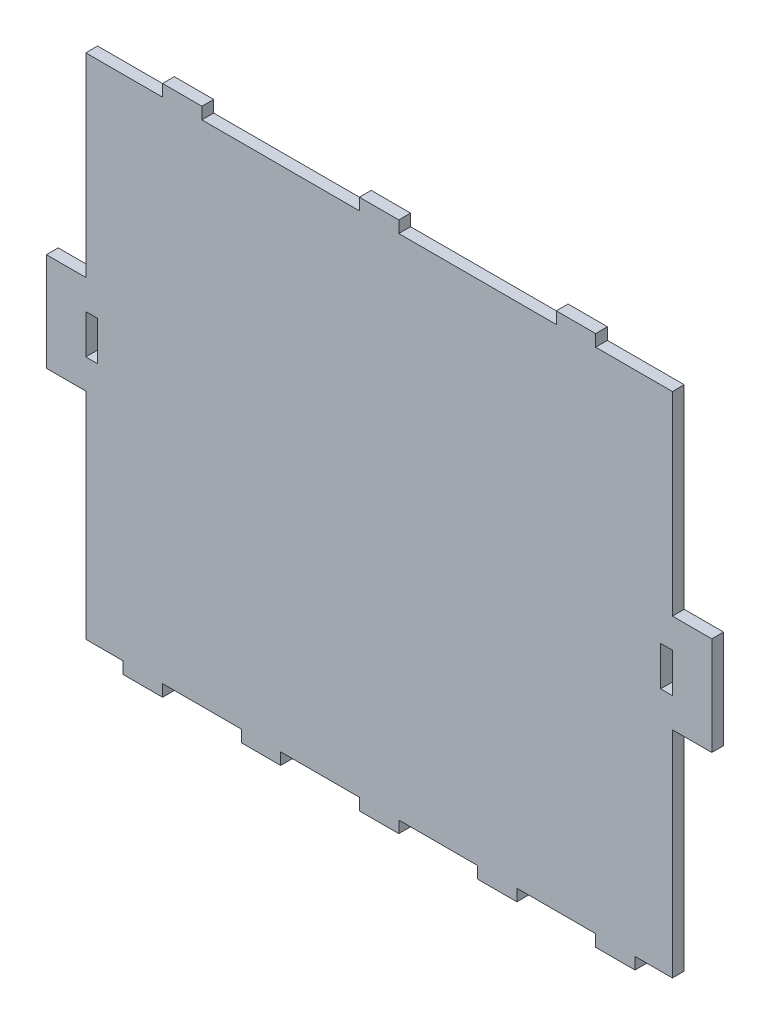
from build123d import *

# Parameters (mm, degrees)
SKETCH1_W           = 3
SKETCH1_H           = 10
BOSS_EXTRUDE1_DEPTH = 3


with BuildPart() as part:
    # Sketch1 → Boss-Extrude1 (new body)
    with BuildSketch(Plane.XY):
        Polygon((-74.5, 61.9), (-55, 61.9), (-55, 64.9), (-45, 64.9), (-45, 61.9), (-5, 61.9), (-5, 64.9), (5, 64.9), (5, 61.9), (45, 61.9), (45, 64.9), (55, 64.9), (55, 61.9), (74.5, 61.9), (74.5, 12.5), (84.5, 12.5), (84.5, -12.5), (74.5, -12.5), (74.5, -67.1), (65, -67.1), (65, -70.1), (55, -70.1), (55, -67.1), (35, -67.1), (35, -70.1), (25, -70.1), (25, -67.1), (5, -67.1), (5, -70.1), (-5, -70.1), (-5, -67.1), (-25, -67.1), (-25, -70.1), (-35, -70.1), (-35, -67.1), (-55, -67.1), (-55, -70.1), (-65, -70.1), (-65, -67.1), (-74.5, -67.1), (-74.5, -12.5), (-84.5, -12.5), (-84.5, 12.5), (-74.5, 12.5), align=None)
        with Locations((73, 0)):
            Rectangle(SKETCH1_W, SKETCH1_H, mode=Mode.SUBTRACT)
        with Locations((-73, 0)):
            Rectangle(SKETCH1_W, SKETCH1_H, mode=Mode.SUBTRACT)
    extrude(amount=BOSS_EXTRUDE1_DEPTH)


solid = part.part
